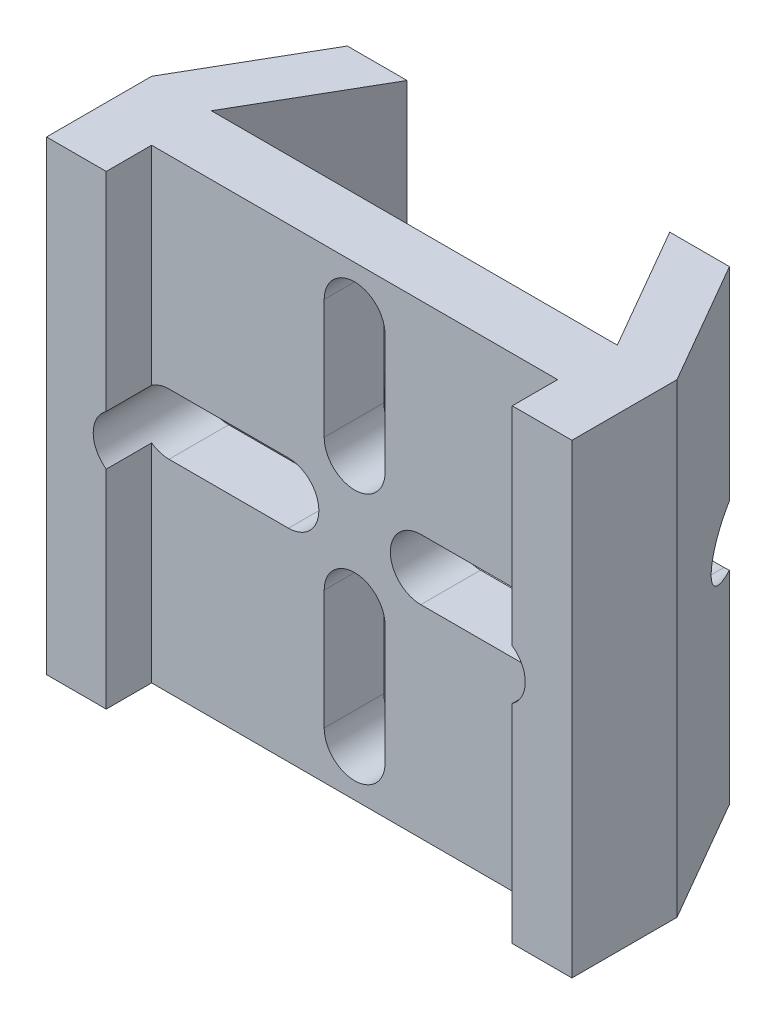
from build123d import *

# Parameters (mm, degrees)
EXTRUDE_1_DEPTH     = 39
CUT_EXTRUDE_1_DEPTH = 49.716984362


with BuildPart() as part:
    # 草图1 → 凸台-拉伸1 (new body)
    with BuildSketch(Plane(origin=(0, 0, 0), x_dir=(1, 0, 0), z_dir=(0, 1, 0))):
        Polygon((-22, 0), (-22, -3.8), (-17, -3.8), (-17, 0), (17, 0), (17, -3.8), (22, -3.8), (22, 0), (22, 5), (16, 15.392304845), (11, 15.392304845), (17, 5), (-17, 5), (-11, 15.392304845), (-16, 15.392304845), (-22, 5), align=None)
    extrude(amount=EXTRUDE_1_DEPTH)

    # 草图2 → 切除-拉伸1 (cut, through all)
    with BuildSketch(Plane.XY.offset(3.8)):
        with BuildLine():
            Line((-2.548549229, 25.043167775), (-2.548549229, 35.043167775))
            ThreePointArc((-2.548549229, 35.043167775), (0, 37.591717003), (2.548549229, 35.043167775))
            Line((2.548549229, 35.043167775), (2.548549229, 25.043167775))
            ThreePointArc((2.548549229, 25.043167775), (0, 22.494618546), (-2.548549229, 25.043167775))
        make_face()
        with BuildLine():
            Line((5.543167775, 16.951450771), (15.543167775, 16.951450771))
            ThreePointArc((15.543167775, 16.951450771), (18.091717003, 19.5), (15.543167775, 22.048549229))
            Line((15.543167775, 22.048549229), (5.543167775, 22.048549229))
            ThreePointArc((5.543167775, 22.048549229), (2.994618546, 19.5), (5.543167775, 16.951450771))
        make_face()
        with BuildLine():
            Line((-2.548549229, 13.956832225), (-2.548549229, 3.956832225))
            ThreePointArc((-2.548549229, 3.956832225), (0, 1.408282997), (2.548549229, 3.956832225))
            Line((2.548549229, 3.956832225), (2.548549229, 13.956832225))
            ThreePointArc((2.548549229, 13.956832225), (0, 16.505381454), (-2.548549229, 13.956832225))
        make_face()
        with BuildLine():
            Line((-5.543167775, 22.048549229), (-15.543167775, 22.048549229))
            ThreePointArc((-15.543167775, 22.048549229), (-18.091717003, 19.5), (-15.543167775, 16.951450771))
            Line((-15.543167775, 16.951450771), (-5.543167775, 16.951450771))
            ThreePointArc((-5.543167775, 16.951450771), (-2.994618546, 19.5), (-5.543167775, 22.048549229))
        make_face()
    extrude(amount=-CUT_EXTRUDE_1_DEPTH, mode=Mode.SUBTRACT)


solid = part.part
